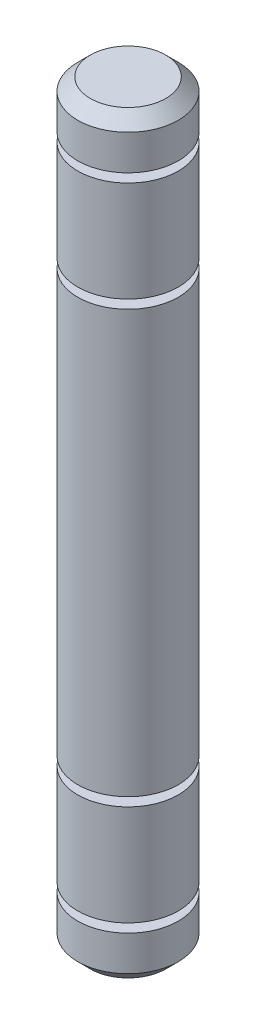
from build123d import *

# Parameters (mm, degrees)
CHAMFER1_SIZE = 1


with BuildPart() as part:
    # Sketch1 → Revolve2 (revolve)
    with BuildSketch(Plane.XY):
        with BuildLine():
            Line((4, 0), (4, 3.8))
            Line((4, 3.8), (2.9, 3.8))
            ThreePointArc((2.9, 3.8), (2.758578644, 3.858578644), (2.7, 4))
            Line((2.7, 4), (2.7, 4.3))
            ThreePointArc((2.7, 4.3), (2.758578644, 4.441421356), (2.9, 4.5))
            Line((2.9, 4.5), (4, 4.5))
            Line((4, 4.5), (4, 12.5))
            Line((4, 12.5), (2.9, 12.5))
            ThreePointArc((2.9, 12.5), (2.758578644, 12.558578644), (2.7, 12.7))
            Line((2.7, 12.7), (2.7, 13))
            ThreePointArc((2.7, 13), (2.758578644, 13.141421356), (2.9, 13.2))
            Line((2.9, 13.2), (4, 13.2))
            Line((4, 13.2), (4, 46.8))
            Line((4, 46.8), (2.9, 46.8))
            ThreePointArc((2.9, 46.8), (2.758578644, 46.858578644), (2.7, 47))
            Line((2.7, 47), (2.7, 47.3))
            ThreePointArc((2.7, 47.3), (2.758578644, 47.441421356), (2.9, 47.5))
            Line((2.9, 47.5), (4, 47.5))
            Line((4, 47.5), (4, 55.5))
            Line((4, 55.5), (2.9, 55.5))
            ThreePointArc((2.9, 55.5), (2.758578644, 55.558578644), (2.7, 55.7))
            Line((2.7, 55.7), (2.7, 56))
            ThreePointArc((2.7, 56), (2.758578644, 56.141421356), (2.9, 56.2))
            Line((2.9, 56.2), (4, 56.2))
            Line((4, 56.2), (4, 60))
            Line((4, 60), (0, 60))
            Line((0, 60), (0, 0))
            Line((0, 0), (4, 0))
        make_face()
    revolve(axis=Axis((0, 0, 0), (0, 1, 0)))

    # Chamfer1
    chamfer1_edges = [part.edges().sort_by_distance(p)[0] for p in [
        (-4, 60, 0),
        (-4, 0, 0),
    ]]
    chamfer(chamfer1_edges, length=CHAMFER1_SIZE)


solid = part.part
